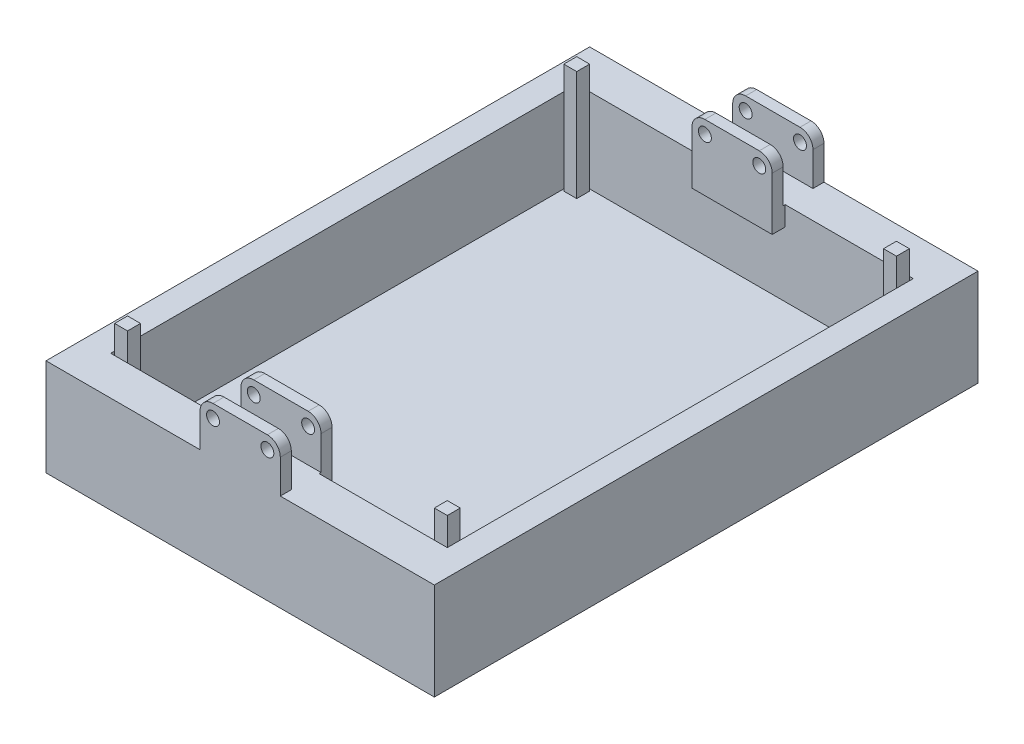
from build123d import *

# Parameters (mm, degrees)
BOSS_EXTRUDE1_DEPTH       = 9
BOSS_EXTRUDE1_DEPTH_BACK  = 6
SKETCH1_W                 = 60
SKETCH1_H                 = 84
SKETCH2_W                 = 52
SKETCH2_H                 = 72
CUT_EXTRUDE2_DEPTH        = 13
BOSS_EXTRUDE6_DEPTH       = 4
BOSS_EXTRUDE6_DEPTH_BACK  = 13
SKETCH4_W                 = 2
SKETCH4_H                 = 2
SKETCH7_R                 = 2
SKETCH7_R_2               = 1
BOSS_EXTRUDE7_DEPTH       = 1.7
SKETCH8_W                 = 12.4
SKETCH8_H                 = 3
BOSS_EXTRUDE8_DEPTH       = 2
MIRROR3_COPY_1_SKETCH_R   = 2
MIRROR3_COPY_1_SKETCH_R_2 = 1
MIRROR3_COPY_1_DEPTH      = 1.7
CUT_EXTRUDE4_DEPTH        = 1


with BuildPart() as part:
    # Sketch1 → Boss-Extrude1 (new, two sides: drawn at the far end of the back side and taken through both)
    with BuildSketch(Plane(origin=(0, 0, 0), x_dir=(1, 0, 0), z_dir=(0, 1, 0)).offset(-BOSS_EXTRUDE1_DEPTH_BACK)):
        Rectangle(SKETCH1_W, SKETCH1_H)
    extrude(amount=BOSS_EXTRUDE1_DEPTH + BOSS_EXTRUDE1_DEPTH_BACK)

    # Sketch2 → Cut-Extrude2 (cut)
    with BuildSketch(Plane(origin=(0, 9, 0), x_dir=(1, 0, 0), z_dir=(0, 1, 0))):
        Rectangle(SKETCH2_W, SKETCH2_H)
    extrude(amount=-CUT_EXTRUDE2_DEPTH, mode=Mode.SUBTRACT)

    # Sketch4 → Boss-Extrude6 (add, two sides: drawn at the far end of the back side and taken through both)
    with BuildSketch(Plane(origin=(0, 9, 0), x_dir=(1, 0, 0), z_dir=(0, 1, 0)).offset(-BOSS_EXTRUDE6_DEPTH_BACK)):
        with Locations((-24.7, 34.7)):
            Rectangle(SKETCH4_W, SKETCH4_H)
        with Locations((24.7, 34.7)):
            Rectangle(SKETCH4_W, SKETCH4_H)
        with Locations((24.7, -34.7)):
            Rectangle(SKETCH4_W, SKETCH4_H)
        with Locations((-24.7, -34.7)):
            Rectangle(SKETCH4_W, SKETCH4_H)
    extrude(amount=BOSS_EXTRUDE6_DEPTH + BOSS_EXTRUDE6_DEPTH_BACK)

    # Sketch7 → Boss-Extrude7 (add)
    # profile 1 of 3: a face of its own
    with BuildSketch(Plane(origin=(0, 0, -42), x_dir=(-1, 0, 0), z_dir=(0, 0, -1))):
        with BuildLine():
            ThreePointArc((-2.2, 14.2), (-4.2, 12.2), (-6.2, 14.2))
            Line((-6.2, 14.2), (-6.2, 9))
            Line((-6.2, 9), (6.2, 9))
            Line((6.2, 9), (6.2, 14.2))
            ThreePointArc((6.2, 14.2), (2.785786438, 12.785786438), (4.2, 16.2))
            Line((4.2, 16.2), (-4.2, 16.2))
            ThreePointArc((-4.2, 16.2), (-2.785786438, 15.614213562), (-2.2, 14.2))
        make_face()
    # profile 2 of 3: a face of its own
    with BuildSketch(Plane(origin=(0, 0, -42), x_dir=(-1, 0, 0), z_dir=(0, 0, -1))):
        with Locations((-4.2, 14.2)):
            Circle(SKETCH7_R)
        with Locations((-4.2, 14.2)):
            Circle(SKETCH7_R_2, mode=Mode.SUBTRACT)
    # profile 3 of 3: a face of its own
    with BuildSketch(Plane(origin=(0, 0, -42), x_dir=(-1, 0, 0), z_dir=(0, 0, -1))):
        with Locations((4.2, 14.2)):
            Circle(SKETCH7_R)
        with Locations((4.2, 14.2)):
            Circle(SKETCH7_R_2, mode=Mode.SUBTRACT)
    boss_extrude7 = extrude(amount=-BOSS_EXTRUDE7_DEPTH)

    # Sketch8 → Boss-Extrude8 (add)
    with BuildSketch(Plane.XY.offset(-36)):
        with Locations((0, 7.5)):
            Rectangle(SKETCH8_W, SKETCH8_H)
    boss_extrude8 = extrude(amount=BOSS_EXTRUDE8_DEPTH)

    # Mirror2: Boss-Extrude7 across plane
    add(boss_extrude7.mirror(Plane(origin=(0, 0, -38), x_dir=(1, 0, 0), z_dir=(0, 0, -1))))

    # Mirror3: Boss-Extrude7, Boss-Extrude8 across plane
    add(boss_extrude7.mirror(Plane.XY))
    add(boss_extrude8.mirror(Plane.XY))

    # Mirror3 copy 1 sketch → Mirror3 copy 1 (add)
    # profile 1 of 3: a face of its own
    with BuildSketch(Plane(origin=(0, 0, 34), x_dir=(-1, 0, 0), z_dir=(0, 0, -1))):
        with BuildLine():
            ThreePointArc((-2.2, 14.2), (-4.2, 12.2), (-6.2, 14.2))
            Line((-6.2, 14.2), (-6.2, 9))
            Line((-6.2, 9), (6.2, 9))
            Line((6.2, 9), (6.2, 14.2))
            ThreePointArc((6.2, 14.2), (2.785786438, 12.785786438), (4.2, 16.2))
            Line((4.2, 16.2), (-4.2, 16.2))
            ThreePointArc((-4.2, 16.2), (-2.785786438, 15.614213562), (-2.2, 14.2))
        make_face()
    # profile 2 of 3: a face of its own
    with BuildSketch(Plane(origin=(0, 0, 34), x_dir=(-1, 0, 0), z_dir=(0, 0, -1))):
        with Locations((-4.2, 14.2)):
            Circle(MIRROR3_COPY_1_SKETCH_R)
        with Locations((-4.2, 14.2)):
            Circle(MIRROR3_COPY_1_SKETCH_R_2, mode=Mode.SUBTRACT)
    # profile 3 of 3: a face of its own
    with BuildSketch(Plane(origin=(0, 0, 34), x_dir=(-1, 0, 0), z_dir=(0, 0, -1))):
        with Locations((4.2, 14.2)):
            Circle(MIRROR3_COPY_1_SKETCH_R)
        with Locations((4.2, 14.2)):
            Circle(MIRROR3_COPY_1_SKETCH_R_2, mode=Mode.SUBTRACT)
    extrude(amount=-MIRROR3_COPY_1_DEPTH)

    # Sketch9 → Cut-Extrude4 (cut)
    # profile 1 of 10: a face of its own
    with BuildSketch(Plane.XZ.offset(6)):
        with BuildLine():
            add(Edge.make_bspline(
                [(0.713739049, 34.775467158), (1.878534198, 34.725374167), (2.24879391, 34.857014036), (2.490005861, 34.550124748)],
                knots=[56, 56, 56, 56, 57, 57, 57, 57], degree=3))
            add(Edge.make_bspline(
                [(2.490005861, 34.550124748), (2.618616322, 34.386498627), (2.624351919, 34.087556784), (2.635823112, 33.48966676)],
                knots=[0, 0, 0, 0, 1, 1, 1, 1], degree=3))
            add(Edge.make_bspline(
                [(2.635823112, 33.48966676), (2.648631556, 32.822189053), (2.626715872, 32.533507908), (2.741865108, 32.035955972)],
                knots=[1, 1, 1, 1, 2, 2, 2, 2], degree=3))
            add(Edge.make_bspline(
                [(2.741865108, 32.035955972), (2.797516242, 31.795479191), (2.866913795, 31.60564678), (2.914192859, 31.4880512)],
                knots=[2, 2, 2, 2, 3, 3, 3, 3], degree=3))
            add(Edge.make_bspline(
                [(2.914192859, 31.4880512), (3.219332949, 31.446051421), (3.628505992, 31.380424785), (4.107203341, 31.27596087)],
                knots=[3, 3, 3, 3, 4, 4, 4, 4], degree=3))
            add(Edge.make_bspline(
                [(4.107203341, 31.27596087), (4.533348681, 31.182961811), (5.136220118, 31.049078404), (5.883470153, 30.772242375)],
                knots=[4, 4, 4, 4, 5, 5, 5, 5], degree=3))
            add(Edge.make_bspline(
                [(5.883470153, 30.772242375), (6.240211602, 30.640082816), (6.701144446, 30.448932168), (7.222304225, 30.175733965)],
                knots=[5, 5, 5, 5, 6, 6, 6, 6], degree=3))
            add(Edge.make_bspline(
                [(7.222304225, 30.175733965), (7.168763537, 30.098173485), (7.071467534, 29.959467107), (6.943928141, 29.791315885)],
                knots=[6, 6, 6, 6, 7, 7, 7, 7], degree=3))
            add(Edge.make_bspline(
                [(6.943928141, 29.791315885), (6.710942493, 29.484128725), (5.961936921, 28.531398556), (4.655133464, 27.533385691)],
                knots=[7, 7, 7, 7, 8, 8, 8, 8], degree=3))
            add(Edge.make_bspline(
                [(4.655133464, 27.533385691), (4.543013637, 27.44775735), (4.364855225, 27.314501372), (4.138137538, 27.157846695)],
                knots=[8, 8, 8, 8, 9, 9, 9, 9], degree=3))
            add(Edge.make_bspline(
                [(4.138137538, 27.157846695), (3.985450246, 27.189750556), (3.758998742, 27.23566702), (3.484184432, 27.285988168)],
                knots=[9, 9, 9, 9, 10, 10, 10, 10], degree=3))
            add(Edge.make_bspline(
                [(3.484184432, 27.285988168), (2.352947278, 27.49313511), (0.147163483, 27.897041544), (-1.73856767, 27.723427246)],
                knots=[10, 10, 10, 10, 11, 11, 11, 11], degree=3))
            add(Edge.make_bspline(
                [(-1.73856767, 27.723427246), (-4.651914973, 27.455204119), (-6.763888487, 25.811971465), (-7.491548766, 25.231351609)],
                knots=[11, 11, 11, 11, 12, 12, 12, 12], degree=3))
            add(Edge.make_bspline(
                [(-7.491548766, 25.231351609), (-9.721067158, 23.452365934), (-10.700447256, 21.36521076), (-11.017571891, 20.618359998), (-12.186873128, 17.864576365), (-11.958925932, 15.417067267), (-11.83942905, 14.282122572)],
                knots=[12, 12, 12, 12, 13, 13, 13, 14, 14, 14, 14], degree=3))
            add(Edge.make_bspline(
                [(-11.83942905, 14.282122572), (-11.746791239, 13.402263002), (-11.583361585, 12.67311337), (-11.441758889, 12.147954517)],
                knots=[14, 14, 14, 14, 15, 15, 15, 15], degree=3))
            add(Edge.make_bspline(
                [(-11.441758889, 12.147954517), (-11.60214012, 12.140152837), (-11.841222612, 12.129670321), (-12.131050877, 12.121444018)],
                knots=[15, 15, 15, 15, 16, 16, 16, 16], degree=3))
            add(Edge.make_bspline(
                [(-12.131050877, 12.121444018), (-13.308610105, 12.088025452), (-13.618414725, 12.140330292), (-14.86173368, 12.147954517)],
                knots=[16, 16, 16, 16, 17, 17, 17, 17], degree=3))
            add(Edge.make_bspline(
                [(-14.86173368, 12.147954517), (-15.988705578, 12.154862584), (-16.192106954, 12.114694393), (-17.552641228, 12.134696098)],
                knots=[17, 17, 17, 17, 18, 18, 18, 18], degree=3))
            add(Edge.make_bspline(
                [(-17.552641228, 12.134696098), (-17.902740793, 12.139842291), (-18.192030355, 12.146953164), (-18.387756805, 12.152371877)],
                knots=[18, 18, 18, 18, 19, 19, 19, 19], degree=3))
            add(Edge.make_bspline(
                [(-18.387756805, 12.152371877), (-18.423298493, 12.535230889), (-18.457762775, 12.842151866), (-18.480546721, 13.036084754)],
                knots=[19, 19, 19, 19, 20, 20, 20, 20], degree=3))
            add(Edge.make_bspline(
                [(-18.480546721, 13.036084754), (-18.543416467, 13.571193758), (-18.641530031, 14.258704859), (-18.705889131, 15.13049023)],
                knots=[20, 20, 20, 20, 21, 21, 21, 21], degree=3))
            add(Edge.make_bspline(
                [(-18.705889131, 15.13049023), (-18.745011606, 15.660415015), (-18.737951435, 15.703878797), (-18.705889131, 15.766767557)],
                knots=[21, 21, 21, 21, 22, 22, 22, 22], degree=3))
            add(Edge.make_bspline(
                [(-18.705889131, 15.766767557), (-18.499299904, 16.172004903), (-17.909389015, 16.099495551), (-16.638000492, 16.509086881)],
                knots=[22, 22, 22, 22, 23, 23, 23, 23], degree=3))
            add(Edge.make_bspline(
                [(-16.638000492, 16.509086881), (-16.15003746, 16.666286598), (-15.906055944, 16.744892795), (-15.802891253, 16.853736044)],
                knots=[23, 23, 23, 23, 24, 24, 24, 24], degree=3))
            add(Edge.make_bspline(
                [(-15.802891253, 16.853736044), (-15.368031609, 17.312539428), (-15.750396282, 17.867105098), (-15.49800467, 19.372322179)],
                knots=[24, 24, 24, 24, 25, 25, 25, 25], degree=3))
            add(Edge.make_bspline(
                [(-15.49800467, 19.372322179), (-15.439229062, 19.722833693), (-15.391430309, 19.854201042), (-15.471494171, 20.035110006)],
                knots=[25, 25, 25, 25, 26, 26, 26, 26], degree=3))
            add(Edge.make_bspline(
                [(-15.471494171, 20.035110006), (-15.600960218, 20.327650796), (-16.041194211, 20.512482781), (-16.916370239, 20.870219245)],
                knots=[26, 26, 26, 26, 27, 27, 27, 27], degree=3))
            add(Edge.make_bspline(
                [(-16.916370239, 20.870219245), (-17.137821316, 20.960740272), (-17.335861018, 21.036057215), (-17.539389148, 21.228120488)],
                knots=[27, 27, 27, 27, 28, 28, 28, 28], degree=3))
            add(Edge.make_bspline(
                [(-17.539389148, 21.228120488), (-17.627634949, 21.311391214), (-17.855341313, 21.52627646), (-17.892873031, 21.829046259)],
                knots=[28, 28, 28, 28, 29, 29, 29, 29], degree=3))
            add(Edge.make_bspline(
                [(-17.892873031, 21.829046259), (-17.926766923, 22.102453605), (-17.789385118, 22.316952252), (-17.680782701, 22.500675144)],
                knots=[29, 29, 29, 29, 30, 30, 30, 30], degree=3))
            add(Edge.make_bspline(
                [(-17.680782701, 22.500675144), (-17.218499933, 23.28269367), (-16.900196489, 24.145352787), (-16.744042488, 24.568563783)],
                knots=[30, 30, 30, 30, 31, 31, 31, 31], degree=3))
            add(Edge.make_bspline(
                [(-16.744042488, 24.568563783), (-16.633513418, 24.86812038), (-16.561682197, 25.111854727), (-16.337537607, 25.399255662), (-16.190173963, 25.588207136), (-16.019303878, 25.80729426), (-15.736611837, 25.894139436)],
                knots=[31, 31, 31, 31, 32, 32, 32, 33, 33, 33, 33], degree=3))
            add(Edge.make_bspline(
                [(-15.736611837, 25.894139436), (-15.443513331, 25.984185137), (-15.174466306, 25.879049429), (-14.636384932, 25.668790687)],
                knots=[33, 33, 33, 33, 34, 34, 34, 34], degree=3))
            add(Edge.make_bspline(
                [(-14.636384932, 25.668790687), (-14.27585989, 25.527910486), (-14.142597576, 25.428491361), (-13.686392638, 25.275537887)],
                knots=[34, 34, 34, 34, 35, 35, 35, 35], degree=3))
            add(Edge.make_bspline(
                [(-13.686392638, 25.275537887), (-13.429704082, 25.189478583), (-13.29916063, 25.146553503), (-13.191508864, 25.151813774)],
                knots=[35, 35, 35, 35, 36, 36, 36, 36], degree=3))
            add(Edge.make_bspline(
                [(-13.191508864, 25.151813774), (-12.899975765, 25.16606087), (-12.76744862, 25.354993332), (-12.237099211, 25.867622599)],
                knots=[36, 36, 36, 36, 37, 37, 37, 37], degree=3))
            add(Edge.make_bspline(
                [(-12.237099211, 25.867622599), (-12.202089888, 25.901459452), (-11.808051215, 26.282068588), (-11.123620225, 27.007618421), (-11.001987546, 27.136558441), (-10.846999677, 27.305470184), (-10.840833119, 27.537847415)],
                knots=[37, 37, 37, 37, 38, 38, 38, 39, 39, 39, 39], degree=3))
            add(Edge.make_bspline(
                [(-10.840833119, 27.537847415), (-10.835465107, 27.740146035), (-10.945575891, 27.889341268), (-11.03524767, 28.015049073)],
                knots=[39, 39, 39, 39, 40, 40, 40, 40], degree=3))
            add(Edge.make_bspline(
                [(-11.03524767, 28.015049073), (-11.137037085, 28.157748187), (-11.393262992, 28.591809284), (-11.905708466, 29.459925141)],
                knots=[40, 40, 40, 40, 41, 41, 41, 41], degree=3))
            add(Edge.make_bspline(
                [(-11.905708466, 29.459925141), (-12.098557612, 29.786626005), (-12.197723229, 29.980901127), (-12.148726655, 30.206661824)],
                knots=[41, 41, 41, 41, 42, 42, 42, 42], degree=3))
            add(Edge.make_bspline(
                [(-12.148726655, 30.206661824), (-12.107443033, 30.396880834), (-11.982020424, 30.521568273), (-11.918960547, 30.577827824)],
                knots=[42, 42, 42, 42, 43, 43, 43, 43], degree=3))
            add(Edge.make_bspline(
                [(-11.918960547, 30.577827824), (-10.864498001, 31.518624149), (-9.29622738, 32.272287913), (-8.666889808, 32.769440575)],
                knots=[43, 43, 43, 43, 44, 44, 44, 44], degree=3))
            add(Edge.make_bspline(
                [(-8.666889808, 32.769440575), (-8.60585165, 32.817657615), (-8.441281215, 32.952225491), (-8.225033369, 32.946179348)],
                knots=[44, 44, 44, 44, 45, 45, 45, 45], degree=3))
            add(Edge.make_bspline(
                [(-8.225033369, 32.946179348), (-7.99126185, 32.939645204), (-7.819358724, 32.772203802), (-7.712480154, 32.663392242)],
                knots=[45, 45, 45, 45, 46, 46, 46, 46], degree=3))
            add(Edge.make_bspline(
                [(-7.712480154, 32.663392242), (-7.092427278, 32.032121678), (-6.917634171, 31.599188688), (-6.36923506, 31.125726259)],
                knots=[46, 46, 46, 46, 47, 47, 47, 47], degree=3))
            add(Edge.make_bspline(
                [(-6.36923506, 31.125726259), (-6.105771528, 30.898260726), (-5.949579501, 30.828508264), (-5.791169288, 30.807593932)],
                knots=[47, 47, 47, 47, 48, 48, 48, 48], degree=3))
            add(Edge.make_bspline(
                [(-5.791169288, 30.807593932), (-5.583578708, 30.780183483), (-5.497893327, 30.853237876), (-5.025989966, 31.002008484)],
                knots=[48, 48, 48, 48, 49, 49, 49, 49], degree=3))
            add(Edge.make_bspline(
                [(-5.025989966, 31.002008484), (-4.716616309, 31.099538981), (-4.398471307, 31.166673984), (-4.084832393, 31.249450371)],
                knots=[49, 49, 49, 49, 50, 50, 50, 50], degree=3))
            add(Edge.make_bspline(
                [(-4.084832393, 31.249450371), (-3.853836776, 31.310412477), (-3.567367479, 31.385887862), (-3.34693043, 31.443864922)],
                knots=[50, 50, 50, 50, 51, 51, 51, 51], degree=3))
            add(Edge.make_bspline(
                [(-3.34693043, 31.443864922), (-3.174811823, 31.49985829), (-3.070766195, 31.581272077), (-3.011115988, 31.638285811)],
                knots=[51, 51, 51, 51, 52, 52, 52, 52], degree=3))
            add(Edge.make_bspline(
                [(-3.011115988, 31.638285811), (-2.692330881, 31.942994939), (-2.627122532, 32.520737491), (-2.586935328, 34.148030889)],
                knots=[52, 52, 52, 52, 53, 53, 53, 53], degree=3))
            add(Edge.make_bspline(
                [(-2.586935328, 34.148030889), (-2.584951635, 34.22823418), (-2.58019204, 34.426064738), (-2.445541774, 34.572217886)],
                knots=[53, 53, 53, 53, 54, 54, 54, 54], degree=3))
            add(Edge.make_bspline(
                [(-2.445541774, 34.572217886), (-2.30960496, 34.719771661), (-2.109226656, 34.740901473), (-2.021354777, 34.748956659)],
                knots=[54, 54, 54, 54, 55, 55, 55, 55], degree=3))
            add(Edge.make_bspline(
                [(-2.021354777, 34.748956659), (-0.951257184, 34.84707656), (0.713726374, 34.775467158), (0.713739049, 34.775467158)],
                knots=[55, 55, 55, 55, 56, 56, 56, 56], degree=3))
        make_face()
    # profile 2 of 10: a face of its own
    with BuildSketch(Plane.XZ.offset(6)):
        with BuildLine():
            add(Edge.make_bspline(
                [(-7.677128597, 6.355204503), (-6.57581795, 5.60486485), (-6.538577765, 4.282347126), (-6.537139113, 4.154753862)],
                knots=[21, 21, 21, 21, 22, 22, 22, 22], degree=3))
            add(Edge.make_bspline(
                [(-6.537139113, 4.154753862), (-5.503191624, 4.154753862), (-4.469250474, 4.154753862), (-3.435302985, 4.154753862)],
                knots=[0, 0, 0, 0, 1, 1, 1, 1], degree=3))
            add(Edge.make_bspline(
                [(-3.435302985, 4.154753862), (-3.422919166, 4.698586678), (-3.450500732, 6.497941644), (-4.760872301, 8.025422981)],
                knots=[1, 1, 1, 1, 2, 2, 2, 2], degree=3))
            add(Edge.make_bspline(
                [(-4.760872301, 8.025422981), (-4.918192434, 8.208809976), (-5.514783234, 8.878772052), (-6.537139113, 9.377509134)],
                knots=[2, 2, 2, 2, 3, 3, 3, 3], degree=3))
            add(Edge.make_bspline(
                [(-6.537139113, 9.377509134), (-8.717597554, 10.441199336), (-10.817833692, 9.742096625), (-11.176641223, 9.616109963)],
                knots=[3, 3, 3, 3, 4, 4, 4, 4], degree=3))
            add(Edge.make_bspline(
                [(-11.176641223, 9.616109963), (-11.669046966, 9.443211822), (-12.650030495, 9.026560321), (-13.536158027, 8.104960816)],
                knots=[4, 4, 4, 4, 5, 5, 5, 5], degree=3))
            add(Edge.make_bspline(
                [(-13.536158027, 8.104960816), (-14.893092501, 6.693712458), (-15.143880681, 5.017533395), (-15.391962674, 3.359410372)],
                knots=[5, 5, 5, 5, 6, 6, 6, 6], degree=3))
            add(Edge.make_bspline(
                [(-15.391962674, 3.359410372), (-15.610606161, 1.898069022), (-15.856704461, 0.253213923), (-15.206382843, -1.730786066)],
                knots=[6, 6, 6, 6, 7, 7, 7, 7], degree=3))
            add(Edge.make_bspline(
                [(-15.206382843, -1.730786066), (-14.906072062, -2.646979533), (-14.13906749, -4.986947775), (-11.918960547, -6.052152682)],
                knots=[7, 7, 7, 7, 8, 8, 8, 8], degree=3))
            add(Edge.make_bspline(
                [(-11.918960547, -6.052152682), (-10.824380511, -6.577330548), (-9.810624859, -6.58438755), (-9.267815578, -6.582381676)],
                knots=[8, 8, 8, 8, 9, 9, 9, 9], degree=3))
            add(Edge.make_bspline(
                [(-9.267815578, -6.582381676), (-8.628306036, -6.580017723), (-6.80151527, -6.573274435), (-5.238080296, -5.256809192)],
                knots=[9, 9, 9, 9, 10, 10, 10, 10], degree=3))
            add(Edge.make_bspline(
                [(-5.238080296, -5.256809192), (-3.305348937, -3.629385871), (-3.2293095, -1.224938113), (-3.223206318, -0.829397411)],
                knots=[10, 10, 10, 10, 11, 11, 11, 11], degree=3))
            add(Edge.make_bspline(
                [(-3.223206318, -0.829397411), (-4.36320214, -0.873583689), (-5.503191624, -0.917769966), (-6.643187446, -0.961956244)],
                knots=[11, 11, 11, 11, 12, 12, 12, 12], degree=3))
            add(Edge.make_bspline(
                [(-6.643187446, -0.961956244), (-6.66365814, -1.266785788), (-6.753849608, -1.946561755), (-7.252947937, -2.579153724)],
                knots=[12, 12, 12, 12, 13, 13, 13, 13], degree=3))
            add(Edge.make_bspline(
                [(-7.252947937, -2.579153724), (-7.432690769, -2.806974166), (-8.006009622, -3.533642598), (-8.949683252, -3.586587544), (-9.715382263, -3.629547482), (-10.269599361, -3.203402142), (-10.460832399, -3.056358551)],
                knots=[13, 13, 13, 13, 14, 14, 14, 15, 15, 15, 15], degree=3))
            add(Edge.make_bspline(
                [(-10.460832399, -3.056358551), (-10.688976062, -2.880934846), (-11.12982481, -2.4824598), (-11.521290386, -1.386136904)],
                knots=[15, 15, 15, 15, 16, 16, 16, 16], degree=3))
            add(Edge.make_bspline(
                [(-11.521290386, -1.386136904), (-12.060278048, 0.123326421), (-11.945737228, 1.387623084), (-11.759891215, 3.438945038)],
                knots=[16, 16, 16, 16, 17, 17, 17, 17], degree=3))
            add(Edge.make_bspline(
                [(-11.759891215, 3.438945038), (-11.739490236, 3.664138513), (-11.68144346, 4.25953783), (-11.415242052, 4.976607852)],
                knots=[17, 17, 17, 17, 18, 18, 18, 18], degree=3))
            add(Edge.make_bspline(
                [(-11.415242052, 4.976607852), (-11.224135768, 5.491404605), (-11.034835721, 5.981753772), (-10.540370233, 6.355204503)],
                knots=[18, 18, 18, 18, 19, 19, 19, 19], degree=3))
            add(Edge.make_bspline(
                [(-10.540370233, 6.355204503), (-10.165648798, 6.638213428), (-9.792264611, 6.720717296), (-9.63897524, 6.752874664)],
                knots=[19, 19, 19, 19, 20, 20, 20, 20], degree=3))
            add(Edge.make_bspline(
                [(-9.63897524, 6.752874664), (-8.606333313, 6.969509108), (-7.774640081, 6.421642362), (-7.677128597, 6.355204503)],
                knots=[20, 20, 20, 20, 21, 21, 21, 21], degree=3))
        make_face()
    # profile 3 of 10: a face of its own
    with BuildSketch(Plane.XZ.offset(6)):
        with BuildLine():
            add(Edge.make_bspline(
                [(10.951570284, -6.255401954), (9.514058596, -1.003376126), (8.076559583, 4.248649702), (6.639047895, 9.500675531)],
                knots=[7, 7, 7, 7, 8, 8, 8, 8], degree=3))
            add(Edge.make_bspline(
                [(6.639047895, 9.500675531), (5.142621171, 9.500675531), (3.646200783, 9.500675531), (2.149774059, 9.500675531)],
                knots=[0, 0, 0, 0, 1, 1, 1, 1], degree=3))
            add(Edge.make_bspline(
                [(2.149774059, 9.500675531), (0.712268708, 4.248649702), (-0.72524298, -1.003376126), (-2.16274833, -6.255401954)],
                knots=[1, 1, 1, 1, 2, 2, 2, 2], degree=3))
            add(Edge.make_bspline(
                [(-2.16274833, -6.255401954), (-1.066945123, -6.255401954), (0.028864421, -6.255401954), (1.124667628, -6.255401954)],
                knots=[2, 2, 2, 2, 3, 3, 3, 3], degree=3))
            add(Edge.make_bspline(
                [(1.124667628, -6.255401954), (1.383891255, -5.183162227), (1.643114882, -4.110922499), (1.902338509, -3.038682772)],
                knots=[3, 3, 3, 3, 4, 4, 4, 4], degree=3))
            add(Edge.make_bspline(
                [(1.902338509, -3.038682772), (3.49302549, -3.038682772), (5.083712471, -3.038682772), (6.674399453, -3.038682772)],
                knots=[4, 4, 4, 4, 5, 5, 5, 5], degree=3))
            add(Edge.make_bspline(
                [(6.674399453, -3.038682772), (6.992538116, -4.110922499), (7.310664105, -5.183162227), (7.628802768, -6.255401954)],
                knots=[5, 5, 5, 5, 6, 6, 6, 6], degree=3))
            add(Edge.make_bspline(
                [(7.628802768, -6.255401954), (8.736387715, -6.255401954), (9.843985337, -6.255401954), (10.951570284, -6.255401954)],
                knots=[6, 6, 6, 6, 7, 7, 7, 7], degree=3))
        make_face()
        with BuildLine():
            add(Edge.make_bspline(
                [(6.002770568, -0.140095916), (4.859834064, -0.140095916), (3.71689756, -0.140095916), (2.573961056, -0.140095916)],
                knots=[2, 2, 2, 2, 3, 3, 3, 3], degree=3))
            add(Edge.make_bspline(
                [(2.573961056, -0.140095916), (3.145429308, 1.933686761), (3.71689756, 4.007469439), (4.288365812, 6.081252117)],
                knots=[0, 0, 0, 0, 1, 1, 1, 1], degree=3))
            add(Edge.make_bspline(
                [(4.288365812, 6.081252117), (4.859834064, 4.007469439), (5.431302316, 1.933686761), (6.002770568, -0.140095916)],
                knots=[1, 1, 1, 1, 2, 2, 2, 2], degree=3))
        make_face(mode=Mode.SUBTRACT)
    # profile 4 of 10: a face of its own
    with BuildSketch(Plane.XZ.offset(6)):
        with BuildLine():
            add(Edge.make_bspline(
                [(12.895753824, 9.500675531), (12.895753824, 4.248649702), (12.895753824, -1.003379295), (12.895753824, -6.255405123)],
                knots=[12, 12, 12, 12, 13, 13, 13, 13], degree=3))
            add(Edge.make_bspline(
                [(12.895753824, -6.255405123), (13.897296774, -6.255405123), (14.898839725, -6.255405123), (15.900382676, -6.255405123)],
                knots=[0, 0, 0, 0, 1, 1, 1, 1], degree=3))
            add(Edge.make_bspline(
                [(15.900382676, -6.255405123), (15.900382676, -2.355278485), (15.900382676, 1.544851321), (15.900382676, 5.444977958)],
                knots=[1, 1, 1, 1, 2, 2, 2, 2], degree=3))
            add(Edge.make_bspline(
                [(15.900382676, 5.444977958), (17.007967622, 1.544851321), (18.115565244, -2.355278485), (19.223150191, -6.255405123)],
                knots=[2, 2, 2, 2, 3, 3, 3, 3], degree=3))
            add(Edge.make_bspline(
                [(19.223150191, -6.255405123), (20.151188775, -6.255405123), (21.079240033, -6.255405123), (22.007278617, -6.255405123)],
                knots=[3, 3, 3, 3, 4, 4, 4, 4], degree=3))
            add(Edge.make_bspline(
                [(22.007278617, -6.255405123), (22.988059341, -2.355278485), (23.968840064, 1.544851321), (24.949620788, 5.444977958)],
                knots=[4, 4, 4, 4, 5, 5, 5, 5], degree=3))
            add(Edge.make_bspline(
                [(24.949620788, 5.444977958), (24.949620788, 1.544851321), (24.949620788, -2.355278485), (24.949620788, -6.255405123)],
                knots=[5, 5, 5, 5, 6, 6, 6, 6], degree=3))
            add(Edge.make_bspline(
                [(24.949620788, -6.255405123), (26.057205735, -6.255405123), (27.164803357, -6.255405123), (28.272388304, -6.255405123)],
                knots=[6, 6, 6, 6, 7, 7, 7, 7], degree=3))
            add(Edge.make_bspline(
                [(28.272388304, -6.255405123), (28.272388304, -1.003379295), (28.272388304, 4.248649702), (28.272388304, 9.500675531)],
                knots=[7, 7, 7, 7, 8, 8, 8, 8], degree=3))
            add(Edge.make_bspline(
                [(28.272388304, 9.500675531), (26.516737952, 9.500675531), (24.761100276, 9.500675531), (23.005449924, 9.500675531)],
                knots=[8, 8, 8, 8, 9, 9, 9, 9], degree=3))
            add(Edge.make_bspline(
                [(23.005449924, 9.500675531), (22.198321525, 5.815770035), (21.391193125, 2.130861371), (20.584064726, -1.554044125)],
                knots=[9, 9, 9, 9, 10, 10, 10, 10], degree=3))
            add(Edge.make_bspline(
                [(20.584064726, -1.554044125), (19.74158477, 2.130861371), (18.899117489, 5.815770035), (18.056637532, 9.500675531)],
                knots=[10, 10, 10, 10, 11, 11, 11, 11], degree=3))
            add(Edge.make_bspline(
                [(18.056637532, 9.500675531), (16.336338738, 9.500675531), (14.616052618, 9.500675531), (12.895753824, 9.500675531)],
                knots=[11, 11, 11, 11, 12, 12, 12, 12], degree=3))
        make_face()
    # profile 5 of 10: a face of its own
    with BuildSketch(Plane.XZ.offset(6)):
        with BuildLine():
            add(Edge.make_bspline(
                [(-21.480758212, 6.328690835), (-20.844360469, 5.777547511), (-20.783201895, 4.994955424), (-20.773784108, 4.81753852)],
                knots=[31, 31, 31, 31, 32, 32, 32, 32], degree=3))
            add(Edge.make_bspline(
                [(-20.773784108, 4.81753852), (-19.73983662, 4.81753852), (-18.705895469, 4.81753852), (-17.671947981, 4.81753852)],
                knots=[0, 0, 0, 0, 1, 1, 1, 1], degree=3))
            add(Edge.make_bspline(
                [(-17.671947981, 4.81753852), (-17.656655168, 5.266150921), (-17.662168946, 6.766918954), (-18.7326468, 8.051933481)],
                knots=[1, 1, 1, 1, 2, 2, 2, 2], degree=3))
            add(Edge.make_bspline(
                [(-18.7326468, 8.051933481), (-19.427845502, 8.886459653), (-20.253004589, 9.246826253), (-20.561693778, 9.377509134)],
                knots=[2, 2, 2, 2, 3, 3, 3, 3], degree=3))
            add(Edge.make_bspline(
                [(-20.561693778, 9.377509134), (-21.420702394, 9.741177662), (-22.143330558, 9.761952565), (-22.841679085, 9.775179294)],
                knots=[3, 3, 3, 3, 4, 4, 4, 4], degree=3))
            add(Edge.make_bspline(
                [(-22.841679085, 9.775179294), (-23.799948383, 9.793330399), (-24.834618367, 9.812926493), (-25.970025711, 9.227274522)],
                knots=[4, 4, 4, 4, 5, 5, 5, 5], degree=3))
            add(Edge.make_bspline(
                [(-25.970025711, 9.227274522), (-26.347212503, 9.032720542), (-27.488431497, 8.423714235), (-28.108617465, 7.106358547), (-28.479979932, 6.317536525), (-28.516770142, 5.588586529), (-28.532798125, 5.197536071)],
                knots=[5, 5, 5, 5, 6, 6, 6, 7, 7, 7, 7], degree=3))
            add(Edge.make_bspline(
                [(-28.532798125, 5.197536071), (-28.54802756, 4.825853551), (-28.575184502, 4.163157621), (-28.320707795, 3.447782927)],
                knots=[7, 7, 7, 7, 8, 8, 8, 8], degree=3))
            add(Edge.make_bspline(
                [(-28.320707795, 3.447782927), (-27.906350533, 2.28295609), (-26.960186196, 1.668280731), (-26.305840154, 1.238494397)],
                knots=[8, 8, 8, 8, 9, 9, 9, 9], degree=3))
            add(Edge.make_bspline(
                [(-26.305840154, 1.238494397), (-25.27340737, 0.560375732), (-24.223305145, 0.273808202), (-23.3542323, 0.036642856)],
                knots=[9, 9, 9, 9, 10, 10, 10, 10], degree=3))
            add(Edge.make_bspline(
                [(-23.3542323, 0.036642856), (-22.284324838, -0.255330712), (-21.715011395, -0.273139582), (-21.233316325, -0.829397411)],
                knots=[10, 10, 10, 10, 11, 11, 11, 11], degree=3))
            add(Edge.make_bspline(
                [(-21.233316325, -0.829397411), (-21.139664486, -0.937546684), (-20.682071598, -1.46596944), (-20.756108329, -2.207994062)],
                knots=[11, 11, 11, 11, 12, 12, 12, 12], degree=3))
            add(Edge.make_bspline(
                [(-20.756108329, -2.207994062), (-20.765988766, -2.3069949), (-20.837471415, -2.9256218), (-21.3570341, -3.339148826)],
                knots=[12, 12, 12, 12, 13, 13, 13, 13], degree=3))
            add(Edge.make_bspline(
                [(-21.3570341, -3.339148826), (-21.827093197, -3.713277689), (-22.366708289, -3.682967753), (-22.824003306, -3.657284321)],
                knots=[13, 13, 13, 13, 14, 14, 14, 14], degree=3))
            add(Edge.make_bspline(
                [(-22.824003306, -3.657284321), (-23.281450428, -3.631591382), (-24.288709962, -3.575018117), (-24.909567724, -2.755895666)],
                knots=[14, 14, 14, 14, 15, 15, 15, 15], degree=3))
            add(Edge.make_bspline(
                [(-24.909567724, -2.755895666), (-25.34406612, -2.182646527), (-25.362305952, -1.53543037), (-25.351424162, -1.25358124)],
                knots=[15, 15, 15, 15, 16, 16, 16, 16], degree=3))
            add(Edge.make_bspline(
                [(-25.351424162, -1.25358124), (-26.476691225, -1.265362979), (-27.601951951, -1.277147888), (-28.727219014, -1.288929628)],
                knots=[16, 16, 16, 16, 17, 17, 17, 17], degree=3))
            add(Edge.make_bspline(
                [(-28.727219014, -1.288929628), (-28.744996195, -1.768717058), (-28.726281038, -3.016095295), (-27.914196576, -4.240537482)],
                knots=[17, 17, 17, 17, 18, 18, 18, 18], degree=3))
            add(Edge.make_bspline(
                [(-27.914196576, -4.240537482), (-27.278280496, -5.199354989), (-26.475480729, -5.662233499), (-26.111419265, -5.866572851)],
                knots=[18, 18, 18, 18, 19, 19, 19, 19], degree=3))
            add(Edge.make_bspline(
                [(-26.111419265, -5.866572851), (-24.750707535, -6.630307182), (-23.447751048, -6.604135749), (-22.788651749, -6.582552793)],
                knots=[19, 19, 19, 19, 20, 20, 20, 20], degree=3))
            add(Edge.make_bspline(
                [(-22.788651749, -6.582552793), (-21.851879848, -6.551875272), (-19.462100641, -6.473617648), (-18.12263914, -4.647045532)],
                knots=[20, 20, 20, 20, 21, 21, 21, 21], degree=3))
            add(Edge.make_bspline(
                [(-18.12263914, -4.647045532), (-17.352903029, -3.597383776), (-17.290768453, -2.46230599), (-17.274271482, -2.06659734)],
                knots=[21, 21, 21, 21, 22, 22, 22, 22], degree=3))
            add(Edge.make_bspline(
                [(-17.274271482, -2.06659734), (-17.258389266, -1.685604774), (-17.196996198, -0.212960178), (-18.193335916, 0.991055679)],
                knots=[22, 22, 22, 22, 23, 23, 23, 23], degree=3))
            add(Edge.make_bspline(
                [(-18.193335916, 0.991055679), (-18.591158181, 1.471803266), (-18.993137962, 1.710961811), (-19.624953565, 2.086862055)],
                knots=[23, 23, 23, 23, 24, 24, 24, 24], degree=3))
            add(Edge.make_bspline(
                [(-19.624953565, 2.086862055), (-20.940813561, 2.869739336), (-22.45296406, 3.266110274), (-22.5412162, 3.288713595)],
                knots=[24, 24, 24, 24, 25, 25, 25, 25], degree=3))
            add(Edge.make_bspline(
                [(-22.5412162, 3.288713595), (-22.740244579, 3.339687524), (-23.306585651, 3.478679098), (-23.972833849, 3.818942589), (-24.46191865, 4.068726247), (-24.676753193, 4.259411076), (-24.821195169, 4.508240915)],
                knots=[25, 25, 25, 25, 26, 26, 26, 27, 27, 27, 27], degree=3))
            add(Edge.make_bspline(
                [(-24.821195169, 4.508240915), (-25.031200403, 4.870004972), (-25.020812952, 5.231309547), (-25.015616058, 5.356605403), (-25.010324098, 5.484198667), (-24.985854331, 5.931122077), (-24.679801615, 6.293342447)],
                knots=[27, 27, 27, 27, 28, 28, 28, 29, 29, 29, 29], degree=3))
            add(Edge.make_bspline(
                [(-24.679801615, 6.293342447), (-24.264398637, 6.784974993), (-23.603226918, 6.797498241), (-23.159811411, 6.805895662)],
                knots=[29, 29, 29, 29, 30, 30, 30, 30], degree=3))
            add(Edge.make_bspline(
                [(-23.159811411, 6.805895662), (-22.729350114, 6.814045914), (-22.055921329, 6.826803656), (-21.480758212, 6.328690835)],
                knots=[30, 30, 30, 30, 31, 31, 31, 31], degree=3))
        make_face()
    # profile 6 of 10: a face of its own
    with BuildSketch(Plane.XZ.offset(6)):
        with BuildLine():
            add(Edge.make_bspline(
                [(14.45108291, -10.709327402), (15.11947958, -10.765032406), (15.715892925, -11.303218352), (15.988755231, -12.070248275)],
                knots=[29, 29, 29, 29, 30, 30, 30, 30], degree=3))
            add(Edge.make_bspline(
                [(15.988755231, -12.070248275), (16.613244481, -12.070248275), (17.237733731, -12.070248275), (17.862222981, -12.070248275)],
                knots=[0, 0, 0, 0, 1, 1, 1, 1], degree=3))
            add(Edge.make_bspline(
                [(17.862222981, -12.070248275), (17.874302591, -11.752071585), (17.873377291, -10.69899699), (17.119903657, -9.878635523)],
                knots=[1, 1, 1, 1, 2, 2, 2, 2], degree=3))
            add(Edge.make_bspline(
                [(17.119903657, -9.878635523), (16.30655166, -8.99308472), (15.1615871, -8.972404883), (14.45108291, -8.959574258), (13.876407794, -8.949196314), (12.946227076, -8.932395134), (12.100400827, -9.578172638)],
                knots=[2, 2, 2, 2, 3, 3, 3, 4, 4, 4, 4], degree=3))
            add(Edge.make_bspline(
                [(12.100400827, -9.578172638), (11.849796439, -9.769500741), (11.259391211, -10.284085182), (11.022273398, -11.168859619)],
                knots=[4, 4, 4, 4, 5, 5, 5, 5], degree=3))
            add(Edge.make_bspline(
                [(11.022273398, -11.168859619), (10.824525229, -11.906701375), (10.977389976, -12.510542476), (11.022273398, -12.671174045)],
                knots=[5, 5, 5, 5, 6, 6, 6, 6], degree=3))
            add(Edge.make_bspline(
                [(11.022273398, -12.671174045), (11.278188758, -13.586942888), (11.936647952, -14.09505973), (12.206455498, -14.297209415)],
                knots=[6, 6, 6, 6, 7, 7, 7, 7], degree=3))
            add(Edge.make_bspline(
                [(12.206455498, -14.297209415), (13.019642716, -14.906475567), (14.057107614, -15.117124076), (14.203647361, -15.145577072), (14.377033503, -15.179242808), (14.802773231, -15.251676107), (15.299456905, -15.499064124)],
                knots=[7, 7, 7, 7, 8, 8, 8, 9, 9, 9, 9], degree=3))
            add(Edge.make_bspline(
                [(15.299456905, -15.499064124), (15.727376794, -15.712197002), (15.856842841, -15.880313366), (15.918052116, -15.976268951)],
                knots=[9, 9, 9, 9, 10, 10, 10, 10], degree=3))
            add(Edge.make_bspline(
                [(15.918052116, -15.976268951), (15.95382196, -16.032347878), (16.203577099, -16.438076394), (16.041776229, -16.877657607)],
                knots=[10, 10, 10, 10, 11, 11, 11, 11], degree=3))
            add(Edge.make_bspline(
                [(16.041776229, -16.877657607), (15.913260833, -17.226797013), (15.605262451, -17.3795255), (15.405498901, -17.478583377), (14.748725529, -17.804260707), (14.099379914, -17.576047329), (14.02690225, -17.549280154), (13.486222429, -17.349598994), (13.215730414, -16.942314578), (13.143189373, -16.82463344)],
                knots=[11, 11, 11, 11, 12, 12, 12, 13, 13, 13, 14, 14, 14, 14], degree=3))
            add(Edge.make_bspline(
                [(13.143189373, -16.82463344), (12.969727179, -16.543202596), (12.915387944, -16.274500974), (12.895753824, -16.117662504)],
                knots=[14, 14, 14, 14, 15, 15, 15, 15], degree=3))
            add(Edge.make_bspline(
                [(12.895753824, -16.117662504), (12.247688419, -16.094095856), (11.599635689, -16.070532376), (10.951570284, -16.046965728)],
                knots=[15, 15, 15, 15, 16, 16, 16, 16], degree=3))
            add(Edge.make_bspline(
                [(10.951570284, -16.046965728), (10.92101001, -16.345524141), (10.86196822, -17.282673134), (11.428784617, -18.079509147)],
                knots=[16, 16, 16, 16, 17, 17, 17, 17], degree=3))
            add(Edge.make_bspline(
                [(11.428784617, -18.079509147), (11.684357743, -18.438798342), (12.004017449, -18.680780321), (12.100400827, -18.751131694)],
                knots=[17, 17, 17, 17, 18, 18, 18, 18], degree=3))
            add(Edge.make_bspline(
                [(12.100400827, -18.751131694), (12.46064701, -19.014075537), (12.783906516, -19.128983942), (13.019465261, -19.210663911)],
                knots=[18, 18, 18, 18, 19, 19, 19, 19], degree=3))
            add(Edge.make_bspline(
                [(13.019465261, -19.210663911), (13.248686329, -19.290147876), (13.831752528, -19.471009307), (14.61015858, -19.458105799), (15.628458346, -19.441225398), (16.356644652, -19.103104042), (16.501308446, -19.03392197)],
                knots=[19, 19, 19, 19, 20, 20, 20, 21, 21, 21, 21], degree=3))
            add(Edge.make_bspline(
                [(16.501308446, -19.03392197), (16.877297417, -18.8541221), (17.312885894, -18.6458217), (17.68547787, -18.167881703)],
                knots=[21, 21, 21, 21, 22, 22, 22, 22], degree=3))
            add(Edge.make_bspline(
                [(17.68547787, -18.167881703), (18.127847661, -17.600441044), (18.205826427, -17.003885101), (18.233382643, -16.771612442)],
                knots=[22, 22, 22, 22, 23, 23, 23, 23], degree=3))
            add(Edge.make_bspline(
                [(18.233382643, -16.771612442), (18.249809899, -16.633131051), (18.375080404, -15.418014754), (17.561766433, -14.456278747)],
                knots=[23, 23, 23, 23, 24, 24, 24, 24], degree=3))
            add(Edge.make_bspline(
                [(17.561766433, -14.456278747), (16.975556747, -13.763092257), (16.164334209, -13.512015712), (15.617595569, -13.342799761)],
                knots=[24, 24, 24, 24, 25, 25, 25, 25], degree=3))
            add(Edge.make_bspline(
                [(15.617595569, -13.342799761), (14.979062029, -13.145175177), (14.379213663, -13.094708262), (13.620391031, -12.635825657)],
                knots=[25, 25, 25, 25, 26, 26, 26, 26], degree=3))
            add(Edge.make_bspline(
                [(13.620391031, -12.635825657), (13.411830787, -12.509699565), (13.166562723, -12.337793271), (13.072486259, -12.034899887)],
                knots=[26, 26, 26, 26, 27, 27, 27, 27], degree=3))
            add(Edge.make_bspline(
                [(13.072486259, -12.034899887), (12.943666655, -11.620130676), (13.18680526, -11.244636043), (13.213879812, -11.204208008)],
                knots=[27, 27, 27, 27, 28, 28, 28, 28], degree=3))
            add(Edge.make_bspline(
                [(13.213879812, -11.204208008), (13.585559163, -10.649154337), (14.378605246, -10.703287597), (14.45108291, -10.709327402)],
                knots=[28, 28, 28, 28, 29, 29, 29, 29], degree=3))
        make_face()
    # profile 7 of 10: a face of its own
    with BuildSketch(Plane.XZ.offset(6)):
        with BuildLine():
            add(Edge.make_bspline(
                [(7.116249553, -19.192991302), (7.104474151, -16.500607075), (7.092686074, -13.808222848), (7.080910672, -11.115838621)],
                knots=[7, 7, 7, 7, 8, 8, 8, 8], degree=3))
            add(Edge.make_bspline(
                [(7.080910672, -11.115838621), (7.952835471, -11.115838621), (8.824772946, -11.115838621), (9.696697745, -11.115838621)],
                knots=[0, 0, 0, 0, 1, 1, 1, 1], degree=3))
            add(Edge.make_bspline(
                [(9.696697745, -11.115838621), (9.696697745, -10.509021981), (9.696697745, -9.902202172), (9.696697745, -9.295385532)],
                knots=[1, 1, 1, 1, 2, 2, 2, 2], degree=3))
            add(Edge.make_bspline(
                [(9.696697745, -9.295385532), (7.210516147, -9.295385532), (4.724328212, -9.295385532), (2.238146614, -9.295385532)],
                knots=[2, 2, 2, 2, 3, 3, 3, 3], degree=3))
            add(Edge.make_bspline(
                [(2.238146614, -9.295385532), (2.238146614, -9.902202172), (2.238146614, -10.509021981), (2.238146614, -11.115838621)],
                knots=[3, 3, 3, 3, 4, 4, 4, 4], degree=3))
            add(Edge.make_bspline(
                [(2.238146614, -11.115838621), (3.127753529, -11.115838621), (4.017360445, -11.115838621), (4.906967361, -11.115838621)],
                knots=[4, 4, 4, 4, 5, 5, 5, 5], degree=3))
            add(Edge.make_bspline(
                [(4.906967361, -11.115838621), (4.918749101, -13.808222848), (4.930530841, -16.500607075), (4.94231258, -19.192991302)],
                knots=[5, 5, 5, 5, 6, 6, 6, 6], degree=3))
            add(Edge.make_bspline(
                [(4.94231258, -19.192991302), (5.666956125, -19.192991302), (6.391606008, -19.192991302), (7.116249553, -19.192991302)],
                knots=[6, 6, 6, 6, 7, 7, 7, 7], degree=3))
        make_face()
    # profile 8 of 10: a face of its own
    with BuildSketch(Plane.XZ.offset(6)):
        with BuildLine():
            add(Edge.make_bspline(
                [(0.647459633, -16.064641506), (0.806427562, -15.477512857), (1.071576916, -14.172826184), (0.647459633, -12.618149878)],
                knots=[9, 9, 9, 9, 10, 10, 10, 10], degree=3))
            add(Edge.make_bspline(
                [(0.647459633, -12.618149878), (0.432320881, -11.829527493), (0.158634677, -10.826279708), (-0.784158017, -10.037701687)],
                knots=[0, 0, 0, 0, 1, 1, 1, 1], degree=3))
            add(Edge.make_bspline(
                [(-0.784158017, -10.037701687), (-1.818542805, -9.172520174), (-3.000925004, -9.115639532), (-3.435302985, -9.100967811), (-3.890893168, -9.085579934), (-5.087471762, -9.062567832), (-6.174814171, -9.878632355)],
                knots=[1, 1, 1, 1, 2, 2, 2, 3, 3, 3, 3], degree=3))
            add(Edge.make_bspline(
                [(-6.174814171, -9.878632355), (-7.145771497, -10.607351025), (-7.469588719, -11.584836158), (-7.694804376, -12.264665995)],
                knots=[3, 3, 3, 3, 4, 4, 4, 4], degree=3))
            add(Edge.make_bspline(
                [(-7.694804376, -12.264665995), (-8.156687871, -13.658916706), (-7.977249248, -14.838744823), (-7.889225265, -15.375343181), (-7.752350475, -16.209736263), (-7.599967391, -17.138687471), (-6.864112497, -18.008812371)],
                knots=[4, 4, 4, 4, 5, 5, 5, 6, 6, 6, 6], degree=3))
            add(Edge.make_bspline(
                [(-6.864112497, -18.008812371), (-5.635927912, -19.461090844), (-3.818238049, -19.524575345), (-3.594365979, -19.528802575), (-3.145918358, -19.53726971), (-1.704863909, -19.495802296), (-0.572067687, -18.415317252)],
                knots=[6, 6, 6, 6, 7, 7, 7, 8, 8, 8, 8], degree=3))
            add(Edge.make_bspline(
                [(-0.572067687, -18.415317252), (0.214000615, -17.665551159), (0.448310837, -16.800166841), (0.647459633, -16.064641506)],
                knots=[8, 8, 8, 8, 9, 9, 9, 9], degree=3))
        make_face()
        with BuildLine():
            add(Edge.make_bspline(
                [(-1.491125783, -13.113033653), (-1.269250081, -14.358824302), (-1.441774299, -15.291026738), (-1.4867718, -15.516736734)],
                knots=[10, 10, 10, 10, 11, 11, 11, 11], degree=3))
            add(Edge.make_bspline(
                [(-1.4867718, -15.516736734), (-1.64129068, -16.291815505), (-1.734581272, -16.759776832), (-2.16274833, -17.125099494)],
                knots=[0, 0, 0, 0, 1, 1, 1, 1], degree=3))
            add(Edge.make_bspline(
                [(-2.16274833, -17.125099494), (-2.691247138, -17.576018809), (-3.37635626, -17.568876248), (-3.56090305, -17.566955932)],
                knots=[1, 1, 1, 1, 2, 2, 2, 2], degree=3))
            add(Edge.make_bspline(
                [(-3.56090305, -17.566955932), (-3.755152821, -17.564927876), (-4.167051065, -17.555548115), (-4.601802969, -17.301838267)],
                knots=[2, 2, 2, 2, 3, 3, 3, 3], degree=3))
            add(Edge.make_bspline(
                [(-4.601802969, -17.301838267), (-5.023556299, -17.055714616), (-5.232433427, -16.716439803), (-5.326452851, -16.559518943)],
                knots=[3, 3, 3, 3, 4, 4, 4, 4], degree=3))
            add(Edge.make_bspline(
                [(-5.326452851, -16.559518943), (-5.519637894, -16.23709601), (-5.610963806, -15.90694745), (-5.679936735, -15.19859807)],
                knots=[4, 4, 4, 4, 5, 5, 5, 5], degree=3))
            add(Edge.make_bspline(
                [(-5.679936735, -15.19859807), (-5.794433191, -14.0226803), (-5.866720724, -13.180992553), (-5.485515846, -12.229314438)],
                knots=[5, 5, 5, 5, 6, 6, 6, 6], degree=3))
            add(Edge.make_bspline(
                [(-5.485515846, -12.229314438), (-5.266992775, -11.683779957), (-5.050801968, -11.479941281), (-4.955286852, -11.398622559)],
                knots=[6, 6, 6, 6, 7, 7, 7, 7], degree=3))
            add(Edge.make_bspline(
                [(-4.955286852, -11.398622559), (-4.443246989, -10.962717198), (-3.800251724, -10.984144881), (-3.56090305, -10.992117678)],
                knots=[7, 7, 7, 7, 8, 8, 8, 8], degree=3))
            add(Edge.make_bspline(
                [(-3.56090305, -10.992117678), (-3.351316102, -10.999101797), (-2.581586329, -11.024744034), (-2.039030555, -11.593043448)],
                knots=[8, 8, 8, 8, 9, 9, 9, 9], degree=3))
            add(Edge.make_bspline(
                [(-2.039030555, -11.593043448), (-1.698266388, -11.94996869), (-1.629223745, -12.337657011), (-1.491125783, -13.113033653)],
                knots=[9, 9, 9, 9, 10, 10, 10, 10], degree=3))
        make_face(mode=Mode.SUBTRACT)
    # profile 9 of 10: a face of its own
    with BuildSketch(Plane.XZ.offset(6)):
        with BuildLine():
            add(Edge.make_bspline(
                [(-9.851071908, -16.612539941), (-9.826076113, -16.049126875), (-9.963318489, -15.635042133), (-9.991730291, -15.552081954)],
                knots=[9, 9, 9, 9, 10, 10, 10, 10], degree=3))
            add(Edge.make_bspline(
                [(-9.991730291, -15.552081954), (-10.297947786, -14.658032327), (-10.990896613, -14.188220399), (-11.247338, -14.032091749)],
                knots=[0, 0, 0, 0, 1, 1, 1, 1], degree=3))
            add(Edge.make_bspline(
                [(-11.247338, -14.032091749), (-11.128354469, -13.952718694), (-10.025497429, -13.190296262), (-9.992465461, -11.858154776)],
                knots=[1, 1, 1, 1, 2, 2, 2, 2], degree=3))
            add(Edge.make_bspline(
                [(-9.992465461, -11.858154776), (-9.986869293, -11.632565196), (-10.000051659, -10.910431371), (-10.522694455, -10.249798354)],
                knots=[2, 2, 2, 2, 3, 3, 3, 3], degree=3))
            add(Edge.make_bspline(
                [(-10.522694455, -10.249798354), (-11.239834191, -9.343314207), (-12.325547818, -9.299191306), (-12.484541098, -9.295382363)],
                knots=[3, 3, 3, 3, 4, 4, 4, 4], degree=3))
            add(Edge.make_bspline(
                [(-12.484541098, -9.295382363), (-14.110573298, -9.295382363), (-15.736611837, -9.295382363), (-17.362644037, -9.295382363)],
                knots=[4, 4, 4, 4, 5, 5, 5, 5], degree=3))
            add(Edge.make_bspline(
                [(-17.362644037, -9.295382363), (-17.362644037, -12.594586399), (-17.362644037, -15.893790435), (-17.362644037, -19.192988133)],
                knots=[5, 5, 5, 5, 6, 6, 6, 6], degree=3))
            add(Edge.make_bspline(
                [(-17.362644037, -19.192988133), (-15.624669464, -19.192988133), (-13.886701229, -19.192988133), (-12.148726655, -19.192988133)],
                knots=[6, 6, 6, 6, 7, 7, 7, 7], degree=3))
            add(Edge.make_bspline(
                [(-12.148726655, -19.192988133), (-11.901329132, -19.169456342), (-11.167819178, -19.066386716), (-10.575715453, -18.468344588)],
                knots=[7, 7, 7, 7, 8, 8, 8, 8], degree=3))
            add(Edge.make_bspline(
                [(-10.575715453, -18.468344588), (-9.903281683, -17.789154856), (-9.865065497, -16.927940729), (-9.851071908, -16.612539941)],
                knots=[8, 8, 8, 8, 9, 9, 9, 9], degree=3))
        make_face()
        with BuildLine():
            add(Edge.make_bspline(
                [(-12.078029879, -16.20603506), (-12.079329102, -16.779119419), (-12.496284812, -17.294176016), (-13.085466868, -17.425562379)],
                knots=[4, 4, 4, 4, 5, 5, 5, 5], degree=3))
            add(Edge.make_bspline(
                [(-13.085466868, -17.425562379), (-13.786546934, -17.425562379), (-14.487626999, -17.425562379), (-15.188707064, -17.425562379)],
                knots=[0, 0, 0, 0, 1, 1, 1, 1], degree=3))
            add(Edge.make_bspline(
                [(-15.188707064, -17.425562379), (-15.188707064, -16.63021572), (-15.188707064, -15.834875398), (-15.188707064, -15.039528738)],
                knots=[1, 1, 1, 1, 2, 2, 2, 2], degree=3))
            add(Edge.make_bspline(
                [(-15.188707064, -15.039528738), (-14.422817923, -15.039528738), (-13.65693512, -15.039528738), (-12.891045979, -15.039528738)],
                knots=[2, 2, 2, 2, 3, 3, 3, 3], degree=3))
            add(Edge.make_bspline(
                [(-12.891045979, -15.039528738), (-12.400186629, -15.232941937), (-12.076882759, -15.699851209), (-12.078029879, -16.20603506)],
                knots=[3, 3, 3, 3, 4, 4, 4, 4], degree=3))
        make_face(mode=Mode.SUBTRACT)
        with BuildLine():
            add(Edge.make_bspline(
                [(-15.188707064, -13.219075649), (-15.188707064, -12.494432104), (-15.188707064, -11.769788559), (-15.188707064, -11.045138676)],
                knots=[4, 4, 4, 4, 5, 5, 5, 5], degree=3))
            add(Edge.make_bspline(
                [(-15.188707064, -11.045138676), (-14.493521038, -11.045138676), (-13.798328673, -11.045138676), (-13.103142647, -11.045138676)],
                knots=[0, 0, 0, 0, 1, 1, 1, 1], degree=3))
            add(Edge.make_bspline(
                [(-13.103142647, -11.045138676), (-12.647419373, -11.220857083), (-12.350138001, -11.65933554), (-12.360816985, -12.132107162)],
                knots=[1, 1, 1, 1, 2, 2, 2, 2], degree=3))
            add(Edge.make_bspline(
                [(-12.360816985, -12.132107162), (-12.372529011, -12.650864962), (-12.75266916, -13.107050886), (-13.279881419, -13.219075649)],
                knots=[2, 2, 2, 2, 3, 3, 3, 3], degree=3))
            add(Edge.make_bspline(
                [(-13.279881419, -13.219075649), (-13.916158747, -13.219075649), (-14.552429737, -13.219075649), (-15.188707064, -13.219075649)],
                knots=[3, 3, 3, 3, 4, 4, 4, 4], degree=3))
        make_face(mode=Mode.SUBTRACT)
    # profile 10 of 10: a face of its own
    with BuildSketch(Plane.XZ.offset(6)):
        with BuildLine():
            add(Edge.make_bspline(
                [(21.66220483, 18.099773862), (21.746166362, 18.249571174), (22.298697638, 19.275279683), (21.803598383, 20.344407612)],
                knots=[52, 52, 52, 52, 53, 53, 53, 53], degree=3))
            add(Edge.make_bspline(
                [(21.803598383, 20.344407612), (21.434175244, 21.142143575), (20.712643498, 21.46491508), (20.513374287, 21.546259152)],
                knots=[0, 0, 0, 0, 1, 1, 1, 1], degree=3))
            add(Edge.make_bspline(
                [(20.513374287, 21.546259152), (19.582521775, 23.702520347), (18.651681939, 25.858787879), (17.720829428, 28.015049073)],
                knots=[1, 1, 1, 1, 2, 2, 2, 2], degree=3))
            add(Edge.make_bspline(
                [(17.720829428, 28.015049073), (17.712856631, 28.625823592), (17.70489651, 29.236591773), (17.696923713, 29.847366292)],
                knots=[2, 2, 2, 2, 3, 3, 3, 3], degree=3))
            add(Edge.make_bspline(
                [(17.696923713, 29.847366292), (17.646095551, 30.078317546), (17.407367969, 31.038367731), (16.474791609, 31.70014153)],
                knots=[3, 3, 3, 3, 4, 4, 4, 4], degree=3))
            add(Edge.make_bspline(
                [(16.474791609, 31.70014153), (15.546715, 32.358727477), (14.563297803, 32.273542773), (14.247833638, 32.230370524)],
                knots=[4, 4, 4, 4, 5, 5, 5, 5], degree=3))
            add(Edge.make_bspline(
                [(14.247833638, 32.230370524), (14.095235074, 32.209487881), (13.312684182, 32.090827572), (12.57761516, 31.461540701)],
                knots=[5, 5, 5, 5, 6, 6, 6, 6], degree=3))
            add(Edge.make_bspline(
                [(12.57761516, 31.461540701), (12.061398768, 31.019614548), (11.799627395, 30.523634356), (11.676220167, 30.242013382)],
                knots=[6, 6, 6, 6, 7, 7, 7, 7], degree=3))
            add(Edge.make_bspline(
                [(11.676220167, 30.242013382), (10.593669041, 29.163879616), (9.511117914, 28.085752187), (8.428566788, 27.007618421)],
                knots=[7, 7, 7, 7, 8, 8, 8, 8], degree=3))
            add(Edge.make_bspline(
                [(8.428566788, 27.007618421), (6.795170208, 25.469952438), (5.16176729, 23.932292793), (3.52837071, 22.39462681)],
                knots=[8, 8, 8, 8, 9, 9, 9, 9], degree=3))
            add(Edge.make_bspline(
                [(3.52837071, 22.39462681), (3.345737898, 22.244392198), (3.163098749, 22.094163925), (2.980465937, 21.943929313)],
                knots=[9, 9, 9, 9, 10, 10, 10, 10], degree=3))
            add(Edge.make_bspline(
                [(2.980465937, 21.943929313), (1.97615976, 21.943929313), (0.97185992, 21.943929313), (-0.032446257, 21.943929313)],
                knots=[10, 10, 10, 10, 11, 11, 11, 11], degree=3))
            add(Edge.make_bspline(
                [(-0.032446257, 21.943929313), (-0.591695469, 21.846563596), (-1.609069935, 21.578727067), (-2.507397493, 20.750918831)],
                knots=[11, 11, 11, 11, 12, 12, 12, 12], degree=3))
            add(Edge.make_bspline(
                [(-2.507397493, 20.750918831), (-3.883636529, 19.482718159), (-4.039182113, 17.767647947), (-4.071573975, 17.410475536), (-4.084730991, 17.265399793), (-4.083089532, 17.21282877), (-4.000877198, 15.324911119)],
                knots=[12, 12, 12, 12, 13, 13, 13, 14, 14, 14, 14], degree=3))
            add(Edge.make_bspline(
                [(-4.000877198, 15.324911119), (-3.990578475, 15.088427074), (-3.922885757, 13.538199816), (-3.912504643, 13.30120242)],
                knots=[14, 14, 14, 14, 15, 15, 15, 15], degree=3))
            add(Edge.make_bspline(
                [(-3.912504643, 13.30120242), (-4.19529175, 13.30120242), (-4.478085194, 13.30120242), (-4.760872301, 13.30120242)],
                knots=[15, 15, 15, 15, 16, 16, 16, 16], degree=3))
            add(Edge.make_bspline(
                [(-4.760872301, 13.30120242), (-4.760872301, 12.9212017), (-4.760872301, 12.541207317), (-4.760872301, 12.161206597)],
                knots=[16, 16, 16, 16, 17, 17, 17, 17], degree=3))
            add(Edge.make_bspline(
                [(-4.760872301, 12.161206597), (-2.227494029, 12.198497483), (-0.408004266, 12.192292899), (0.806528965, 12.178882376)],
                knots=[17, 17, 17, 17, 18, 18, 18, 18], degree=3))
            add(Edge.make_bspline(
                [(0.806528965, 12.178882376), (1.157870713, 12.175003718), (1.79251292, 12.166834454), (2.715354609, 12.161206597)],
                knots=[18, 18, 18, 18, 19, 19, 19, 19], degree=3))
            add(Edge.make_bspline(
                [(2.715354609, 12.161206597), (4.135196857, 12.152549332), (5.291119259, 12.155680144), (6.047444846, 12.15969823)],
                knots=[19, 19, 19, 19, 20, 20, 20, 20], degree=3))
            add(Edge.make_bspline(
                [(6.047444846, 12.15969823), (6.047888484, 12.301972721), (6.045042867, 12.449906756), (6.038122125, 12.603069373)],
                knots=[20, 20, 20, 20, 21, 21, 21, 21], degree=3))
            add(Edge.make_bspline(
                [(6.038122125, 12.603069373), (6.027702986, 12.833500938), (6.009133595, 13.051865567), (5.985101127, 13.257016142)],
                knots=[21, 21, 21, 21, 22, 22, 22, 22], degree=3))
            add(Edge.make_bspline(
                [(5.985101127, 13.257016142), (5.808356016, 13.292367699), (5.631617244, 13.327712919), (5.454872133, 13.363064476)],
                knots=[22, 22, 22, 22, 23, 23, 23, 23], degree=3))
            add(Edge.make_bspline(
                [(5.454872133, 13.363064476), (5.475488593, 14.824139643), (5.496111391, 16.285208473), (5.516727852, 17.746283641)],
                knots=[23, 23, 23, 23, 24, 24, 24, 24], degree=3))
            add(Edge.make_bspline(
                [(5.516727852, 17.746283641), (5.590371648, 17.864113715), (5.664015444, 17.981943788), (5.73765924, 18.099773862)],
                knots=[24, 24, 24, 24, 25, 25, 25, 25], degree=3))
            add(Edge.make_bspline(
                [(5.73765924, 18.099773862), (5.907337841, 18.252898454), (6.08013458, 18.416220366), (6.254629815, 18.590233938)],
                knots=[25, 25, 25, 25, 26, 26, 26, 26], degree=3))
            add(Edge.make_bspline(
                [(6.254629815, 18.590233938), (6.539216822, 18.874041411), (6.796272963, 19.154331473), (7.027876998, 19.425343177)],
                knots=[26, 26, 26, 26, 27, 27, 27, 27], degree=3))
            add(Edge.make_bspline(
                [(7.027876998, 19.425343177), (7.640590846, 20.038050688), (8.253292018, 20.650764535), (8.866005866, 21.263472046)],
                knots=[27, 27, 27, 27, 28, 28, 28, 28], degree=3))
            add(Edge.make_bspline(
                [(8.866005866, 21.263472046), (9.581314015, 21.950114885), (10.296609487, 22.636757724), (11.011917636, 23.323400564)],
                knots=[28, 28, 28, 28, 29, 29, 29, 29], degree=3))
            add(Edge.make_bspline(
                [(11.011917636, 23.323400564), (11.851951249, 24.197987187), (12.691984862, 25.07257381), (13.532018476, 25.947160434)],
                knots=[29, 29, 29, 29, 30, 30, 30, 30], degree=3))
            add(Edge.make_bspline(
                [(13.532018476, 25.947160434), (13.614496992, 26.000181432), (13.696988184, 26.053208768), (13.779466701, 26.106229766)],
                knots=[30, 30, 30, 30, 31, 31, 31, 31], degree=3))
            add(Edge.make_bspline(
                [(13.779466701, 26.106229766), (13.856051178, 26.01785721), (13.932648332, 25.929484655), (14.009232809, 25.8411121)],
                knots=[31, 31, 31, 31, 32, 32, 32, 32], degree=3))
            add(Edge.make_bspline(
                [(14.009232809, 25.8411121), (14.521786024, 24.798329891), (15.034339239, 23.755547682), (15.546892455, 22.712765473)],
                knots=[32, 32, 32, 32, 33, 33, 33, 33], degree=3))
            add(Edge.make_bspline(
                [(15.546892455, 22.712765473), (16.000530633, 21.858510115), (16.454181487, 21.004248419), (16.907819665, 20.14999306)],
                knots=[33, 33, 33, 33, 34, 34, 34, 34], degree=3))
            add(Edge.make_bspline(
                [(16.907819665, 20.14999306), (16.724863632, 19.795482473), (16.720224453, 19.530136651), (16.748743995, 19.354646401)],
                knots=[34, 34, 34, 34, 35, 35, 35, 35], degree=3))
            add(Edge.make_bspline(
                [(16.748743995, 19.354646401), (16.806252068, 19.000737893), (17.024889217, 18.850490606), (17.066882659, 18.453257745)],
                knots=[35, 35, 35, 35, 36, 36, 36, 36], degree=3))
            add(Edge.make_bspline(
                [(17.066882659, 18.453257745), (17.092005207, 18.215651931), (17.04064468, 18.015203912), (16.996179545, 17.887683532)],
                knots=[36, 36, 36, 36, 37, 37, 37, 37], degree=3))
            add(Edge.make_bspline(
                [(16.996179545, 17.887683532), (16.112466668, 17.475284612), (15.228753791, 17.062879354), (14.345040914, 16.650480434)],
                knots=[37, 37, 37, 37, 38, 38, 38, 38], degree=3))
            add(Edge.make_bspline(
                [(14.345040914, 16.650480434), (13.46737418, 13.0512318), (13.869094116, 12.571013408), (14.062253807, 12.479345261)],
                knots=[38, 38, 38, 38, 39, 39, 39, 39], degree=3))
            add(Edge.make_bspline(
                [(14.062253807, 12.479345261), (14.152578367, 12.43647722), (14.383206399, 12.390345276), (14.592476463, 12.479345261)],
                knots=[39, 39, 39, 39, 40, 40, 40, 40], degree=3))
            add(Edge.make_bspline(
                [(14.592476463, 12.479345261), (14.905266128, 12.612373082), (15.021752615, 12.984090459), (15.087360238, 13.203995144)],
                knots=[40, 40, 40, 40, 41, 41, 41, 41], degree=3))
            add(Edge.make_bspline(
                [(15.087360238, 13.203995144), (15.375268186, 14.168906327), (15.58306791, 15.215617895), (15.670616567, 15.678395002)],
                knots=[41, 41, 41, 41, 42, 42, 42, 42], degree=3))
            add(Edge.make_bspline(
                [(15.670616567, 15.678395002), (16.501308446, 15.955294407), (17.332000325, 16.232187475), (18.162692204, 16.509086881)],
                knots=[42, 42, 42, 42, 43, 43, 43, 43], degree=3))
            add(Edge.make_bspline(
                [(18.162692204, 16.509086881), (18.46904279, 15.631261705), (18.775406052, 14.753442867), (19.081756638, 13.875617691)],
                knots=[43, 43, 43, 43, 44, 44, 44, 44], degree=3))
            add(Edge.make_bspline(
                [(19.081756638, 13.875617691), (18.447773549, 13.088617751), (17.974032262, 12.460769533), (17.720829428, 12.106347673), (17.660773609, 12.022284738), (17.538507162, 11.846230434), (17.544084317, 11.613308163)],
                knots=[44, 44, 44, 44, 45, 45, 45, 46, 46, 46, 46], degree=3))
            add(Edge.make_bspline(
                [(17.544084317, 11.613308163), (17.547962975, 11.451184071), (17.614635327, 11.226069817), (17.773850426, 11.136100167)],
                knots=[46, 46, 46, 46, 47, 47, 47, 47], degree=3))
            add(Edge.make_bspline(
                [(17.773850426, 11.136100167), (17.845085905, 11.095849586), (18.056092492, 11.014131591), (18.586872864, 11.365866276), (18.998631678, 11.638728581), (21.114452162, 13.041661909), (20.831512951, 14.670958013)],
                knots=[47, 47, 47, 47, 48, 48, 48, 49, 49, 49, 49], degree=3))
            add(Edge.make_bspline(
                [(20.831512951, 14.670958013), (20.662297, 15.645407398), (19.733333115, 16.134682329), (19.985331792, 16.631112496)],
                knots=[49, 49, 49, 49, 50, 50, 50, 50], degree=3))
            add(Edge.make_bspline(
                [(19.985331792, 16.631112496), (20.108726345, 16.8742004), (20.363146013, 16.819284436), (20.86244081, 17.198385206)],
                knots=[50, 50, 50, 50, 51, 51, 51, 51], degree=3))
            add(Edge.make_bspline(
                [(20.86244081, 17.198385206), (20.963995732, 17.275495711), (21.38523571, 17.60559357), (21.66220483, 18.099773862)],
                knots=[51, 51, 51, 51, 52, 52, 52, 52], degree=3))
        make_face()
        with BuildLine():
            add(Edge.make_bspline(
                [(20.676860979, 19.306042763), (20.679928414, 18.63664474), (20.064349937, 18.134599392), (19.444068904, 18.113025943)],
                knots=[3, 3, 3, 3, 4, 4, 4, 4], degree=3))
            add(Edge.make_bspline(
                [(19.444068904, 18.113025943), (18.780488868, 18.089944126), (18.119545305, 18.617029633), (18.118505926, 19.299223423)],
                knots=[0, 0, 0, 0, 1, 1, 1, 1], degree=3))
            add(Edge.make_bspline(
                [(18.118505926, 19.299223423), (18.117441196, 20.004169471), (18.821544333, 20.53503857), (19.497102577, 20.485801165)],
                knots=[1, 1, 1, 1, 2, 2, 2, 2], degree=3))
            add(Edge.make_bspline(
                [(19.497102577, 20.485801165), (20.08588536, 20.44288876), (20.673869596, 19.957809371), (20.676860979, 19.306042763)],
                knots=[2, 2, 2, 2, 3, 3, 3, 3], degree=3))
        make_face(mode=Mode.SUBTRACT)
        with BuildLine():
            add(Edge.make_bspline(
                [(17.948174544, 21.496971045), (17.90054057, 21.491539657), (17.787805988, 21.485379436), (17.667808429, 21.546259152)],
                knots=[11, 11, 11, 11, 12, 12, 12, 12], degree=3))
            add(Edge.make_bspline(
                [(17.667808429, 21.546259152), (17.491963269, 21.635468281), (17.432389114, 21.801724537), (17.42037288, 21.837887317)],
                knots=[0, 0, 0, 0, 1, 1, 1, 1], degree=3))
            add(Edge.make_bspline(
                [(17.42037288, 21.837887317), (16.81944711, 23.013228359), (16.218521339, 24.1885694), (15.617595569, 25.363910442)],
                knots=[1, 1, 1, 1, 2, 2, 2, 2], degree=3))
            add(Edge.make_bspline(
                [(15.617595569, 25.363910442), (15.527245659, 25.477925235), (15.506166548, 25.626290232), (15.564561896, 25.743904824)],
                knots=[2, 2, 2, 2, 3, 3, 3, 3], degree=3))
            add(Edge.make_bspline(
                [(15.564561896, 25.743904824), (15.615922422, 25.847354711), (15.710658004, 25.890514285), (15.741307006, 25.902974156)],
                knots=[3, 3, 3, 3, 4, 4, 4, 4], degree=3))
            add(Edge.make_bspline(
                [(15.741307006, 25.902974156), (16.064655239, 26.014713723), (16.336757024, 26.082032518), (16.536647328, 26.123905544)],
                knots=[4, 4, 4, 4, 5, 5, 5, 5], degree=3))
            add(Edge.make_bspline(
                [(16.536647328, 26.123905544), (16.6976243, 26.157621981), (16.804211336, 26.173155625), (16.916654385, 26.123905544), (17.121209218, 26.034309818), (17.190860279, 25.801134039), (17.208276212, 25.735070104)],
                knots=[5, 5, 5, 5, 6, 6, 6, 7, 7, 7, 7], degree=3))
            add(Edge.make_bspline(
                [(17.208276212, 25.735070104), (18.017597448, 23.901263531), (18.603933888, 22.591468691), (18.745935858, 22.350440532)],
                knots=[7, 7, 7, 7, 8, 8, 8, 8], degree=3))
            add(Edge.make_bspline(
                [(18.745935858, 22.350440532), (18.772516071, 22.305316278), (18.877467987, 22.138217111), (18.825473693, 21.97044615)],
                knots=[8, 8, 8, 8, 9, 9, 9, 9], degree=3))
            add(Edge.make_bspline(
                [(18.825473693, 21.97044615), (18.816550245, 21.941660425), (18.795002146, 21.887010644), (18.728266417, 21.820211538)],
                knots=[9, 9, 9, 9, 10, 10, 10, 10], degree=3))
            add(Edge.make_bspline(
                [(18.728266417, 21.820211538), (18.507512484, 21.5992548), (18.063152663, 21.516522776), (17.948174544, 21.496971045)],
                knots=[10, 10, 10, 10, 11, 11, 11, 11], degree=3))
        make_face(mode=Mode.SUBTRACT)
        with BuildLine():
            add(Edge.make_bspline(
                [(14.680849019, 27.475985359), (13.780442703, 27.495042751), (13.071827141, 28.271103862), (13.072486259, 29.146203837)],
                knots=[3, 3, 3, 3, 4, 4, 4, 4], degree=3))
            add(Edge.make_bspline(
                [(13.072486259, 29.146203837), (13.073183403, 30.069920125), (13.863985949, 30.86050719), (14.795738411, 30.816428653)],
                knots=[0, 0, 0, 0, 1, 1, 1, 1], degree=3))
            add(Edge.make_bspline(
                [(14.795738411, 30.816428653), (15.671326387, 30.775005602), (16.361347207, 30.011182543), (16.359914893, 29.146210175)],
                knots=[1, 1, 1, 1, 2, 2, 2, 2], degree=3))
            add(Edge.make_bspline(
                [(16.359914893, 29.146210175), (16.358419201, 28.244903909), (15.606542662, 27.456395602), (14.680849019, 27.475985359)],
                knots=[2, 2, 2, 2, 3, 3, 3, 3], degree=3))
        make_face(mode=Mode.SUBTRACT)
        with BuildLine():
            add(Edge.make_bspline(
                [(3.484184432, 17.251406205), (3.483455599, 15.758668007), (2.290457792, 14.450812496), (0.780018465, 14.388170906)],
                knots=[3, 3, 3, 3, 4, 4, 4, 4], degree=3))
            add(Edge.make_bspline(
                [(0.780018465, 14.388170906), (-0.816023852, 14.321980217), (-2.161195599, 15.671239766), (-2.16274833, 17.244783333), (-2.164383451, 18.902053939), (-0.675073936, 20.255432977), (0.939087797, 20.101389422)],
                knots=[0, 0, 0, 0, 1, 1, 1, 2, 2, 2, 2], degree=3))
            add(Edge.make_bspline(
                [(0.939087797, 20.101389422), (2.35785264, 19.965997648), (3.484894252, 18.703082599), (3.484184432, 17.251406205)],
                knots=[2, 2, 2, 2, 3, 3, 3, 3], degree=3))
        make_face(mode=Mode.SUBTRACT)
    extrude(amount=-CUT_EXTRUDE4_DEPTH, mode=Mode.SUBTRACT)


solid = part.part
